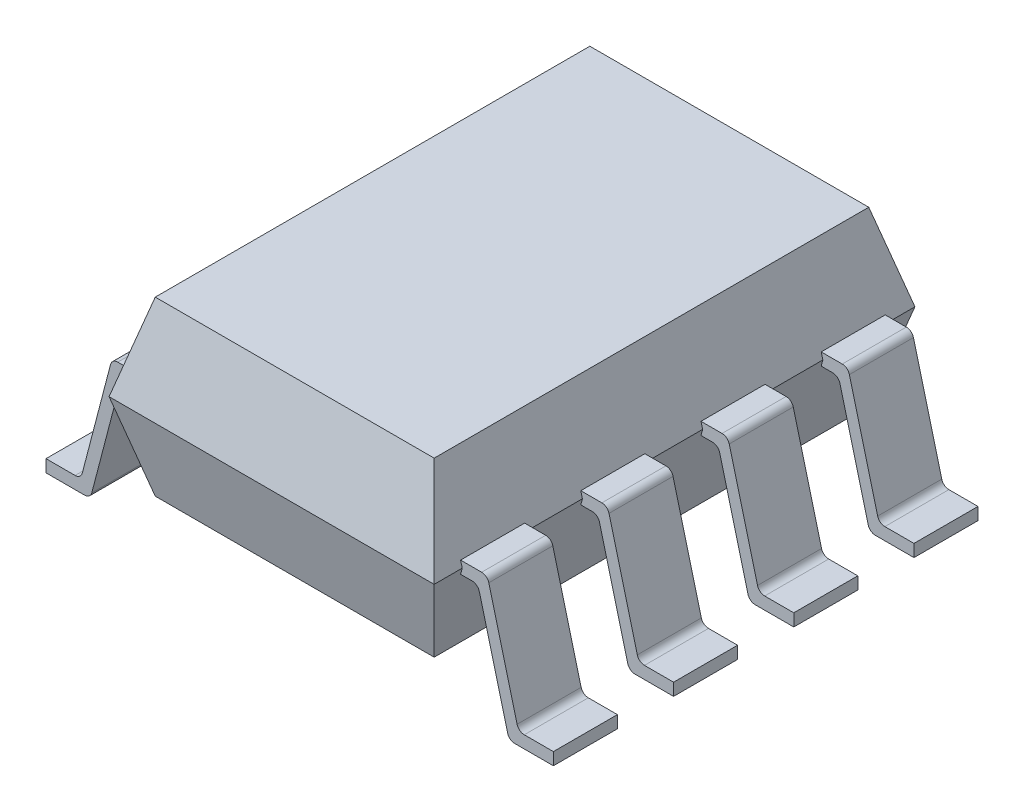
from build123d import *

# Parameters (mm, degrees)
SKETCH2_W                     = 6.6
SKETCH2_H                     = 9.76
BOSS_EXTRUDE1_DEPTH           = 1.75
BOSS_EXTRUDE1_TAPER           = 15
BOSS_EXTRUDE1_OTHER_WAY_DEPTH = 1.75
BOSS_EXTRUDE1_OTHER_WAY_TAPER = 15
BOSS_EXTRUDE2_DEPTH           = 0.65
FILLET1_R                     = 0.15
BOSS_EXTRUDE3_DEPTH           = 0.65
BOSS_EXTRUDE4_DEPTH           = 0.65
BOSS_EXTRUDE5_DEPTH           = 0.65


with BuildPart() as part:
    # Sketch2 → Boss-Extrude1 (new body)
    with BuildSketch(Plane(origin=(0, 0, 0), x_dir=(1, 0, 0), z_dir=(0, 1, 0))):
        Rectangle(SKETCH2_W, SKETCH2_H)
    extrude(amount=BOSS_EXTRUDE1_DEPTH, taper=BOSS_EXTRUDE1_TAPER)

    # Sketch2 → Boss-Extrude1 other way (add)
    with BuildSketch(Plane(origin=(0, 0, 0), x_dir=(1, 0, 0), z_dir=(0, 1, 0))):
        Rectangle(SKETCH2_W, SKETCH2_H)
    extrude(amount=-BOSS_EXTRUDE1_OTHER_WAY_DEPTH, taper=BOSS_EXTRUDE1_OTHER_WAY_TAPER)

    # Sketch3 → Boss-Extrude2 (add, symmetric)
    with BuildSketch(Plane.XY.offset(3.66)):
        Polygon((3.266506351, 0.125), (3.3, 0), (3.266506351, -0.125), (3.616889449, -0.125), (4.25, -2.55), (5.15, -2.55), (5.15, -2.3), (4.443110551, -2.3), (3.81, 0.125), align=None)
        Polygon((-4.25, -2.55), (-5.15, -2.55), (-5.15, -2.3), (-4.443110551, -2.3), (-3.81, 0.125), (-3.266506351, 0.125), (-3.3, 0), (-3.266506351, -0.125), (-3.616889449, -0.125), align=None)
    extrude(amount=BOSS_EXTRUDE2_DEPTH, both=True)

    # Fillet1
    fillet1_edges = [part.edges().sort_by_distance(p)[0] for p in [
        (4.443110551, -2.3, 3.66),
        (3.81, 0.125, 3.66),
        (3.616889449, -0.125, 3.66),
        (4.25, -2.55, 3.66),
        (-4.25, -2.55, 3.66),
        (-3.616889449, -0.125, 3.66),
        (-3.81, 0.125, 3.66),
        (-4.443110551, -2.3, 3.66),
    ]]
    fillet(fillet1_edges, radius=FILLET1_R)

    # Sketch5 → Boss-Extrude3 (add, symmetric)
    with BuildSketch(Plane.XY.offset(1.22)):
        with BuildLine():
            Line((-5.15, -2.55), (-4.365866331, -2.55))
            ThreePointArc((-4.365866331, -2.55), (-4.274170395, -2.518709121), (-4.220731079, -2.437891406))
            Line((-4.220731079, -2.437891406), (-3.64615837, -0.237108594))
            ThreePointArc((-3.64615837, -0.237108594), (-3.592719053, -0.156290879), (-3.501023118, -0.125))
            Line((-3.501023118, -0.125), (-3.266506351, -0.125))
            Line((-3.266506351, -0.125), (-3.3, 0))
            Line((-3.3, 0), (-3.266506351, 0.125))
            Line((-3.266506351, 0.125), (-3.694133669, 0.125))
            ThreePointArc((-3.694133669, 0.125), (-3.785829605, 0.093709121), (-3.839268921, 0.012891406))
            Line((-3.839268921, 0.012891406), (-4.41384163, -2.187891406))
            ThreePointArc((-4.41384163, -2.187891406), (-4.467280947, -2.268709121), (-4.558976882, -2.3))
            Line((-4.558976882, -2.3), (-5.15, -2.3))
            Line((-5.15, -2.3), (-5.15, -2.55))
        make_face()
        with BuildLine():
            Line((3.64615837, -0.237108594), (4.220731079, -2.437891406))
            ThreePointArc((4.220731079, -2.437891406), (4.274170395, -2.518709121), (4.365866331, -2.55))
            Line((4.365866331, -2.55), (5.15, -2.55))
            Line((5.15, -2.55), (5.15, -2.3))
            Line((5.15, -2.3), (4.558976882, -2.3))
            ThreePointArc((4.558976882, -2.3), (4.467280947, -2.268709121), (4.41384163, -2.187891406))
            Line((4.41384163, -2.187891406), (3.839268921, 0.012891406))
            ThreePointArc((3.839268921, 0.012891406), (3.785829605, 0.093709121), (3.694133669, 0.125))
            Line((3.694133669, 0.125), (3.266506351, 0.125))
            Line((3.266506351, 0.125), (3.3, 0))
            Line((3.3, 0), (3.266506351, -0.125))
            Line((3.266506351, -0.125), (3.501023118, -0.125))
            ThreePointArc((3.501023118, -0.125), (3.592719053, -0.156290879), (3.64615837, -0.237108594))
        make_face()
    extrude(amount=BOSS_EXTRUDE3_DEPTH, both=True)

    # Sketch6 → Boss-Extrude4 (add, symmetric)
    with BuildSketch(Plane.XY.offset(-1.22)):
        with BuildLine():
            Line((3.64615837, -0.237108594), (4.220731079, -2.437891406))
            ThreePointArc((4.220731079, -2.437891406), (4.274170395, -2.518709121), (4.365866331, -2.55))
            Line((4.365866331, -2.55), (5.15, -2.55))
            Line((5.15, -2.55), (5.15, -2.3))
            Line((5.15, -2.3), (4.558976882, -2.3))
            ThreePointArc((4.558976882, -2.3), (4.467280947, -2.268709121), (4.41384163, -2.187891406))
            Line((4.41384163, -2.187891406), (3.839268921, 0.012891406))
            ThreePointArc((3.839268921, 0.012891406), (3.785829605, 0.093709121), (3.694133669, 0.125))
            Line((3.694133669, 0.125), (3.266506351, 0.125))
            Line((3.266506351, 0.125), (3.3, 0))
            Line((3.3, 0), (3.266506351, -0.125))
            Line((3.266506351, -0.125), (3.501023118, -0.125))
            ThreePointArc((3.501023118, -0.125), (3.592719053, -0.156290879), (3.64615837, -0.237108594))
        make_face()
        with BuildLine():
            Line((-5.15, -2.55), (-4.365866331, -2.55))
            ThreePointArc((-4.365866331, -2.55), (-4.274170395, -2.518709121), (-4.220731079, -2.437891406))
            Line((-4.220731079, -2.437891406), (-3.64615837, -0.237108594))
            ThreePointArc((-3.64615837, -0.237108594), (-3.592719053, -0.156290879), (-3.501023118, -0.125))
            Line((-3.501023118, -0.125), (-3.266506351, -0.125))
            Line((-3.266506351, -0.125), (-3.3, 0))
            Line((-3.3, 0), (-3.266506351, 0.125))
            Line((-3.266506351, 0.125), (-3.694133669, 0.125))
            ThreePointArc((-3.694133669, 0.125), (-3.785829605, 0.093709121), (-3.839268921, 0.012891406))
            Line((-3.839268921, 0.012891406), (-4.41384163, -2.187891406))
            ThreePointArc((-4.41384163, -2.187891406), (-4.467280947, -2.268709121), (-4.558976882, -2.3))
            Line((-4.558976882, -2.3), (-5.15, -2.3))
            Line((-5.15, -2.3), (-5.15, -2.55))
        make_face()
    extrude(amount=BOSS_EXTRUDE4_DEPTH, both=True)

    # Sketch7 → Boss-Extrude5 (add, symmetric)
    with BuildSketch(Plane.XY.offset(-3.66)):
        with BuildLine():
            Line((3.64615837, -0.237108594), (4.220731079, -2.437891406))
            ThreePointArc((4.220731079, -2.437891406), (4.274170395, -2.518709121), (4.365866331, -2.55))
            Line((4.365866331, -2.55), (5.15, -2.55))
            Line((5.15, -2.55), (5.15, -2.3))
            Line((5.15, -2.3), (4.558976882, -2.3))
            ThreePointArc((4.558976882, -2.3), (4.467280947, -2.268709121), (4.41384163, -2.187891406))
            Line((4.41384163, -2.187891406), (3.839268921, 0.012891406))
            ThreePointArc((3.839268921, 0.012891406), (3.785829605, 0.093709121), (3.694133669, 0.125))
            Line((3.694133669, 0.125), (3.266506351, 0.125))
            Line((3.266506351, 0.125), (3.3, 0))
            Line((3.3, 0), (3.266506351, -0.125))
            Line((3.266506351, -0.125), (3.501023118, -0.125))
            ThreePointArc((3.501023118, -0.125), (3.592719053, -0.156290879), (3.64615837, -0.237108594))
        make_face()
        with BuildLine():
            Line((-5.15, -2.3), (-5.15, -2.55))
            Line((-5.15, -2.55), (-4.365866331, -2.55))
            ThreePointArc((-4.365866331, -2.55), (-4.274170395, -2.518709121), (-4.220731079, -2.437891406))
            Line((-4.220731079, -2.437891406), (-3.64615837, -0.237108594))
            ThreePointArc((-3.64615837, -0.237108594), (-3.592719053, -0.156290879), (-3.501023118, -0.125))
            Line((-3.501023118, -0.125), (-3.266506351, -0.125))
            Line((-3.266506351, -0.125), (-3.3, 0))
            Line((-3.3, 0), (-3.266506351, 0.125))
            Line((-3.266506351, 0.125), (-3.694133669, 0.125))
            ThreePointArc((-3.694133669, 0.125), (-3.785829605, 0.093709121), (-3.839268921, 0.012891406))
            Line((-3.839268921, 0.012891406), (-4.41384163, -2.187891406))
            ThreePointArc((-4.41384163, -2.187891406), (-4.467280947, -2.268709121), (-4.558976882, -2.3))
            Line((-4.558976882, -2.3), (-5.15, -2.3))
        make_face()
    extrude(amount=BOSS_EXTRUDE5_DEPTH, both=True)


solid = part.part
